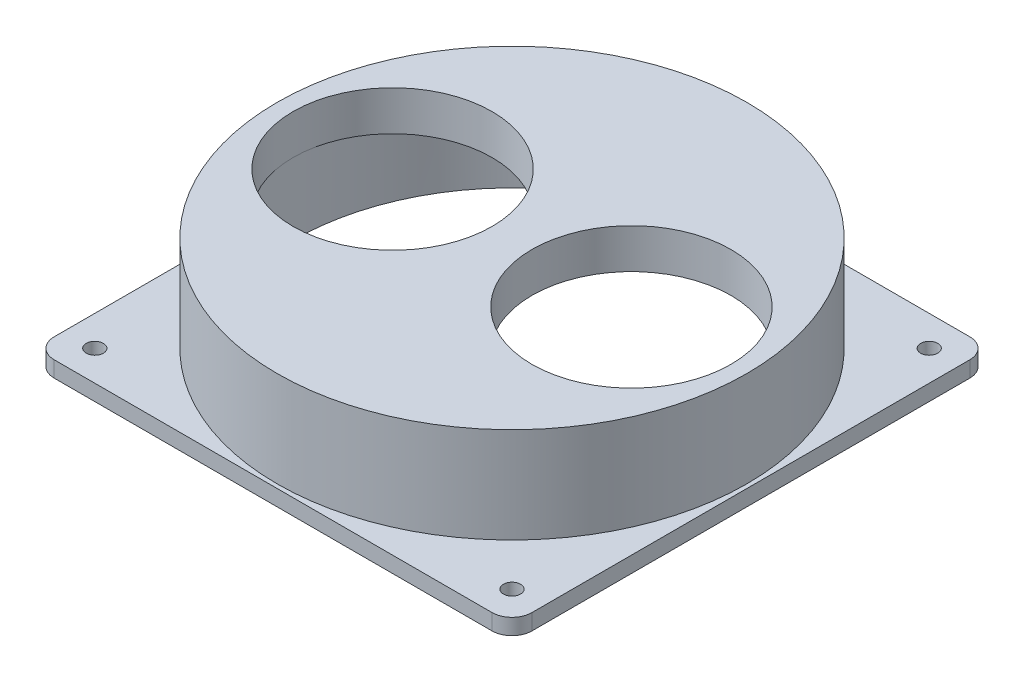
from build123d import *

# Parameters (mm, degrees)
SKETCH1_W           = 120
SKETCH1_H           = 120
BOSS_EXTRUDE1_DEPTH = 4
FILLET1_R           = 5
SKETCH2_R           = 2.15
CUT_EXTRUDE1_DEPTH  = 4
SKETCH3_R           = 55
CUT_EXTRUDE2_DEPTH  = 4
BOSS_EXTRUDE2_START = 20
SKETCH5_R           = 59
SKETCH5_R_2         = 55
BOSS_EXTRUDE2_DEPTH = 20
BOSS_EXTRUDE3_START = 4
SKETCH6_R           = 59
BOSS_EXTRUDE3_DEPTH = 4
SKETCH7_R           = 25
CUT_EXTRUDE3_DEPTH  = 4
SKETCH8_R           = 29
SKETCH8_R_2         = 25
BOSS_EXTRUDE4_DEPTH = 6


with BuildPart() as part:
    # Sketch1 → Boss-Extrude1 (new body)
    with BuildSketch(Plane(origin=(0, 0, 0), x_dir=(1, 0, 0), z_dir=(0, 1, 0))):
        Rectangle(SKETCH1_W, SKETCH1_H)
    extrude(amount=BOSS_EXTRUDE1_DEPTH)

    # Fillet1
    fillet1_edges = [part.edges().sort_by_distance(p)[0] for p in [
        (60, 2, 60),
        (-60, 2, 60),
        (-60, 2, -60),
        (60, 2, -60),
    ]]
    fillet(fillet1_edges, radius=FILLET1_R)

    # Sketch2 → Cut-Extrude1 (cut)
    with BuildSketch(Plane(origin=(0, 4, 0), x_dir=(1, 0, 0), z_dir=(0, 1, 0))):
        with Locations(Location((-52.4, 52.4, 0), (0, 0, 270))):
            Circle(SKETCH2_R)
        with Locations(Location((52.4, 52.4, 0), (0, 0, 270))):
            Circle(SKETCH2_R)
        with Locations(Location((-52.4, -52.4, 0), (0, 0, 270))):
            Circle(SKETCH2_R)
        with Locations(Location((52.4, -52.4, 0), (0, 0, 270))):
            Circle(SKETCH2_R)
    extrude(amount=-CUT_EXTRUDE1_DEPTH, mode=Mode.SUBTRACT)

    # Sketch3 → Cut-Extrude2 (cut)
    with BuildSketch(Plane(origin=(0, 4, 0), x_dir=(1, 0, 0), z_dir=(0, 1, 0))):
        with Locations(Location((0, 0, 0), (0, 0, 270))):
            Circle(SKETCH3_R)
    extrude(amount=-CUT_EXTRUDE2_DEPTH, mode=Mode.SUBTRACT)

    # Sketch5 → Boss-Extrude2 (add)
    with BuildSketch(Plane(origin=(0, 4, 0), x_dir=(1, 0, 0), z_dir=(0, 1, 0)).offset(BOSS_EXTRUDE2_START)):
        with Locations(Location((0, 0, 0), (0, 0, 270))):
            Circle(SKETCH5_R)
        with Locations(Location((0, 0, 0), (0, 0, 270))):
            Circle(SKETCH5_R_2, mode=Mode.SUBTRACT)
    extrude(amount=-BOSS_EXTRUDE2_DEPTH)

    # Sketch6 → Boss-Extrude3 (add)
    with BuildSketch(Plane(origin=(0, 24, 0), x_dir=(1, 0, 0), z_dir=(0, 1, 0)).offset(BOSS_EXTRUDE3_START)):
        with Locations(Location((0, 0, 0), (0, 0, 270))):
            Circle(SKETCH6_R)
    extrude(amount=-BOSS_EXTRUDE3_DEPTH)

    # Sketch7 → Cut-Extrude3 (cut)
    with BuildSketch(Plane(origin=(0, 28, 0), x_dir=(1, 0, 0), z_dir=(0, 1, 0))):
        with Locations(Location((30, 0, 0), (0, 0, 270))):
            Circle(SKETCH7_R)
        with Locations(Location((-30, 0, 0), (0, 0, 270))):
            Circle(SKETCH7_R)
    extrude(amount=-CUT_EXTRUDE3_DEPTH, mode=Mode.SUBTRACT)

    # Sketch8 → Boss-Extrude4 (add)
    # profile 1 of 2: a face of its own
    with BuildSketch(Plane.XZ.offset(-24)):
        with Locations((30, 0)):
            Circle(SKETCH8_R)
        with Locations(Location((30, 0, 0), (0, 0, 90))):
            Circle(SKETCH8_R_2, mode=Mode.SUBTRACT)
    # profile 2 of 2: a face of its own
    with BuildSketch(Plane.XZ.offset(-24)):
        with Locations((-30, 0)):
            Circle(SKETCH8_R)
        with Locations(Location((-30, 0, 0), (0, 0, 90))):
            Circle(SKETCH8_R_2, mode=Mode.SUBTRACT)
    extrude(amount=BOSS_EXTRUDE4_DEPTH)


solid = part.part
